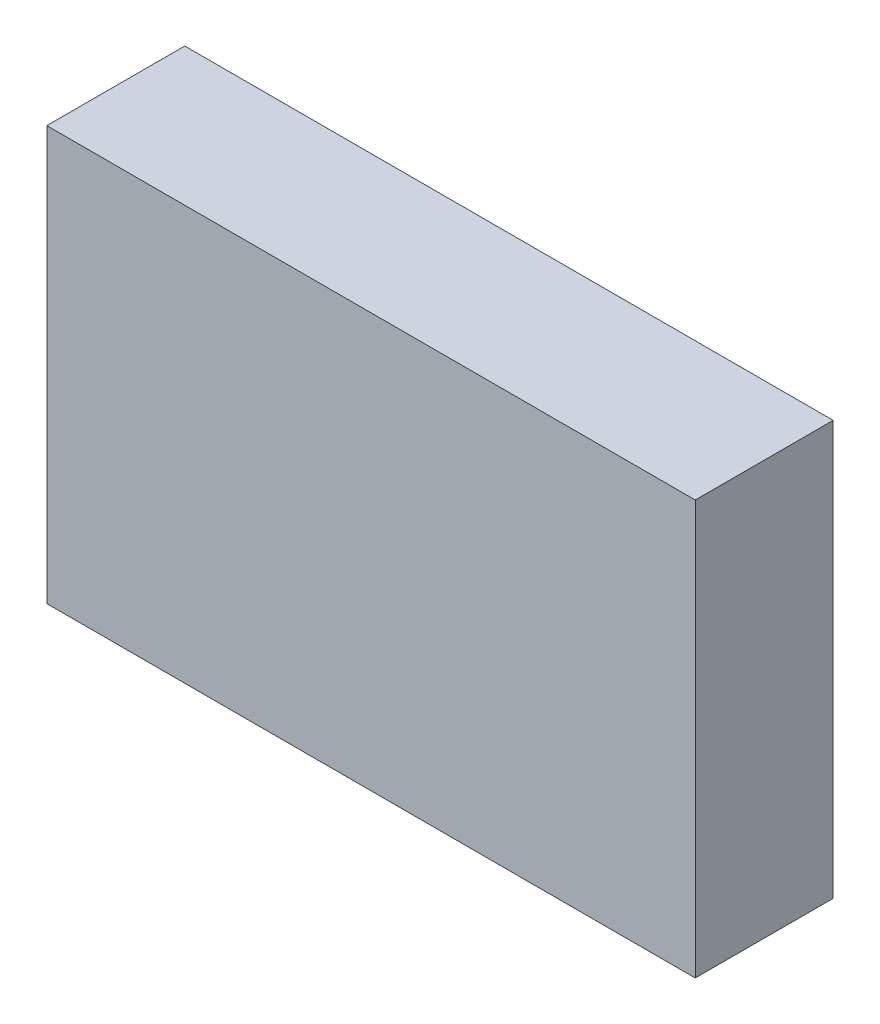
from build123d import *

# Parameters (mm, degrees)
SKETCH1_W               = 4.7016
SKETCH1_H               = 3.0016
COMPONENT_OUTLINE_DEPTH = 1


with BuildPart() as part:
    # Sketch1 → Component_Outline (new body)
    with BuildSketch(Plane.XY):
        with Locations((-0.0508, 0.0508)):
            Rectangle(SKETCH1_W, SKETCH1_H)
    extrude(amount=COMPONENT_OUTLINE_DEPTH)


solid = part.part
